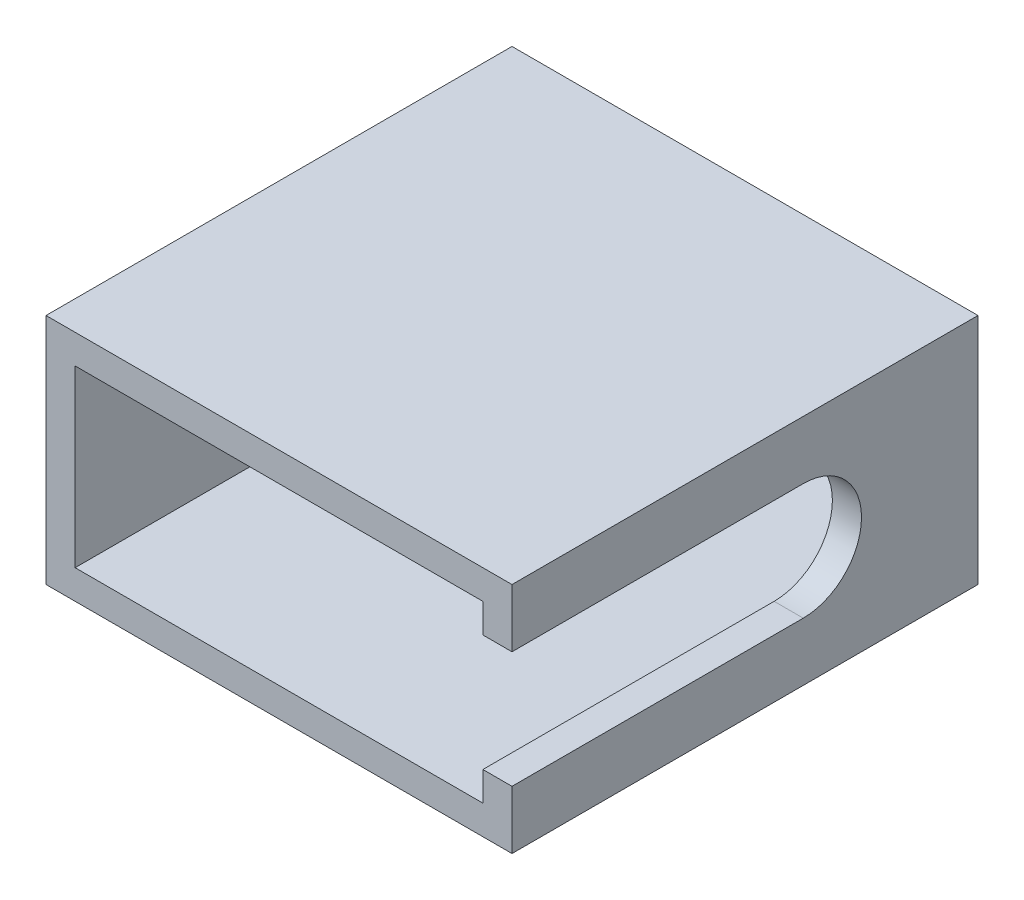
from build123d import *

# Parameters (mm, degrees)
SKETCH1_W           = 50.8
SKETCH1_H           = 25.4
BOSS_EXTRUDE1_DEPTH = 50.8
SHELL1_T            = -3.175
CUT_EXTRUDE1_REACH  = 74.956


with BuildPart() as part:
    # Sketch1 → Boss-Extrude1 (new body)
    with BuildSketch(Plane.XY):
        Rectangle(SKETCH1_W, SKETCH1_H)
    extrude(amount=BOSS_EXTRUDE1_DEPTH)

    # Shell1
    shell1_openings = [part.faces().sort_by_distance(p)[0] for p in [
        (0, 0, 50.8),
        (0, 0, 0),
    ]]
    offset(amount=SHELL1_T, openings=shell1_openings, kind=Kind.INTERSECTION)

    # Sketch2 → Cut-Extrude1 (cut, up to next)
    with BuildSketch(Plane(origin=(25.4, 0, 0), x_dir=(0, 0, -1), z_dir=(1, 0, 0)), mode=Mode.PRIVATE) as cut_extrude1_sk1:
        with BuildLine():
            Line((-50.8, -6.35), (-19.05, -6.35))
            ThreePointArc((-19.05, -6.35), (-12.7, 0), (-19.05, 6.35))
            Line((-19.05, 6.35), (-50.8, 6.35))
            Line((-50.8, 6.35), (-50.8, -6.35))
        make_face()
    cut_extrude1_tool1 = extrude(cut_extrude1_sk1.sketch, amount=-CUT_EXTRUDE1_REACH, mode=Mode.PRIVATE) & part.part
    add(cut_extrude1_tool1.solids().sort_by_distance((25.4, 0, 32.404022))[0], mode=Mode.SUBTRACT)


solid = part.part
